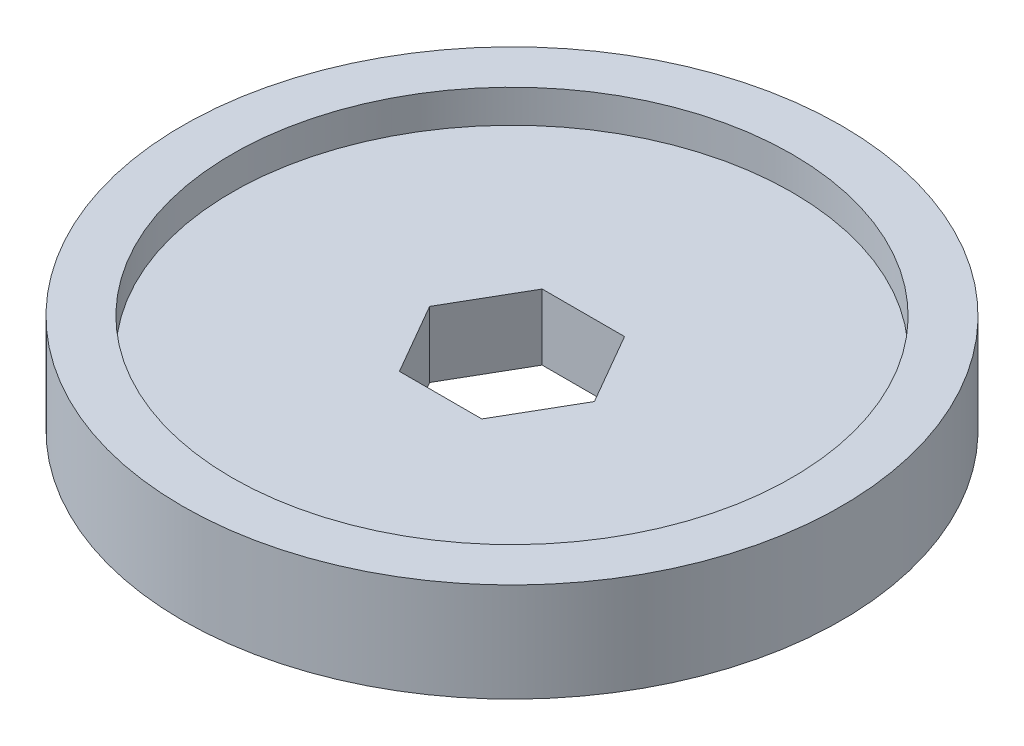
from build123d import *

# Parameters (mm, degrees)
SKETCH1_R           = 25.4
BOSS_EXTRUDE1_DEPTH = 5.08
SKETCH2_R           = 25.4
SKETCH2_R_2         = 21.59
BOSS_EXTRUDE2_DEPTH = 2.54


with BuildPart() as part:
    # Sketch1 → Boss-Extrude1 (new body)
    with BuildSketch(Plane(origin=(0, 0, 0), x_dir=(1, 0, 0), z_dir=(0, 1, 0))):
        with Locations(Location((0, 0, 0), (0, 0, 270))):
            Circle(SKETCH1_R)
        Polygon((6.35, 0), (3.175, 5.499261314), (-3.175, 5.499261314), (-6.35, 0), (-3.175, -5.499261314), (3.175, -5.499261314), align=None, mode=Mode.SUBTRACT)
    extrude(amount=BOSS_EXTRUDE1_DEPTH)

    # Sketch2 → Boss-Extrude2 (add)
    with BuildSketch(Plane(origin=(0, 5.08, 0), x_dir=(1, 0, 0), z_dir=(0, 1, 0))):
        with Locations(Location((0, 0, 0), (0, 0, 270))):
            Circle(SKETCH2_R)
        with Locations(Location((0, 0, 0), (0, 0, 270))):
            Circle(SKETCH2_R_2, mode=Mode.SUBTRACT)
    extrude(amount=BOSS_EXTRUDE2_DEPTH)


solid = part.part
